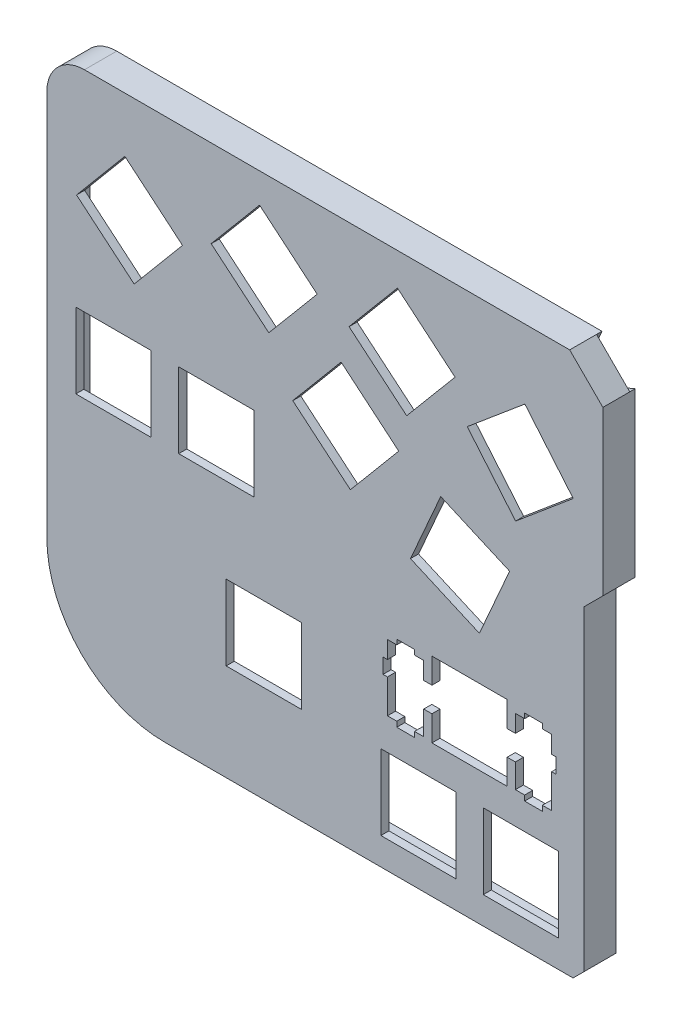
from build123d import *

# Parameters (mm, degrees)
MODEL_W         = 13.9993
MODEL_H         = 13.9993
EXTRUDE_1_DEPTH = 1.5
EXTRUDE_START   = 3.5
EXTRUDE_2_DEPTH = 3.5
CHAMFER_1_SIZE  = 2
EXTRUDE_START_2 = 1
EXTRUDE_3_DEPTH = 1


with BuildPart() as part:
    # Model → 凸台-拉伸1 (new body)
    with BuildSketch(Plane.XY):
        with BuildLine():
            Line((45.999313773, 49.434568323), (-44.302972349, 49.434568323))
            ThreePointArc((-44.302972349, 49.434568323), (-49.252719817, 47.384315792), (-51.302972349, 42.434568323))
            Line((-51.302972349, 42.434568323), (-51.302972349, -29.48760905))
            ThreePointArc((-51.302972349, -29.48760905), (-44.859321535, -45.043958236), (-29.302972349, -51.48760905))
            Line((-29.302972349, -51.48760905), (48.628680412, -51.48760905))
            Line((48.628680412, -51.48760905), (48.628680412, 9.328079248))
            Line((48.628680412, 9.328079248), (52.178865693, 12.878264529))
            Line((52.178865693, 12.878264529), (52.178865693, 43.255016404))
            Line((52.178865693, 43.255016404), (45.999313773, 49.434568323))
        make_face()
        Polygon((37.658208977, 36.530428762), (26.934123004, 27.531852177), (35.932699588, 16.807766205), (46.656785561, 25.806342789), align=None, mode=Mode.SUBTRACT)
        Polygon((13.937335593, 43.369798663), (4.938759009, 32.64571269), (15.662844981, 23.647136106), (24.661421566, 34.371222079), align=None, mode=Mode.SUBTRACT)
        Polygon((-11.724299854, 43.912488191), (-20.722876438, 33.188402219), (-9.998790465, 24.189825635), (-1.000213881, 34.913911607), align=None, mode=Mode.SUBTRACT)
        Polygon((-36.782315633, 39.237800689), (-45.780892217, 28.513714717), (-35.056806244, 19.515138133), (-26.05822966, 30.239224105), align=None, mode=Mode.SUBTRACT)
        Polygon((34.81841009, 8.16776686), (22.000122493, 13.79554649), (16.372342863, 0.977258893), (29.19063046, -4.650520737), align=None, mode=Mode.SUBTRACT)
        Polygon((3.45628169, 26.205455431), (-5.542294894, 15.481369459), (5.181791078, 6.482792875), (14.180367663, 17.206878847), align=None, mode=Mode.SUBTRACT)
        with Locations((17.862828836, -39.410351083)):
            Rectangle(MODEL_W, MODEL_H, mode=Mode.SUBTRACT)
        with Locations((36.913128836, -39.410351083)):
            Rectangle(MODEL_W, MODEL_H, mode=Mode.SUBTRACT)
        Polygon((20.363631661, -17.43145013), (18.837631661, -17.43145013), (18.837631661, -14.20145013), (17.112631661, -14.20145013), (17.112631661, -13.28205013), (13.813631661, -13.28205013), (13.813631661, -14.20145013), (12.086831661, -14.20145013), (12.086831661, -17.43145013), (11.262731661, -17.43145013), (11.262731661, -20.23165013), (12.086831661, -20.23165013), (12.086831661, -26.50175013), (13.813631661, -26.50175013), (13.813631661, -27.48155013), (17.112631661, -27.48155013), (17.112631661, -26.50175013), (18.837631661, -26.50175013), (18.837631661, -22.03145013), (20.363631661, -22.03145013), (20.363631661, -26.73185013), (34.362631661, -26.73185013), (34.362631661, -22.03145013), (35.888631661, -22.03145013), (35.888631661, -26.50175013), (37.613631661, -26.50175013), (37.613631661, -27.48155013), (40.912631661, -27.48155013), (40.912631661, -26.50175013), (42.637631661, -26.50175013), (42.637631661, -20.23165013), (43.463631661, -20.23165013), (43.463631661, -17.43145013), (42.637631661, -17.43145013), (42.637631661, -14.20145013), (40.912631661, -14.20145013), (40.912631661, -13.28205013), (37.613631661, -13.28205013), (37.613631661, -14.20145013), (35.888631661, -14.20145013), (35.888631661, -17.43145013), (34.362631661, -17.43145013), (34.362631661, -12.73245013), (20.363631661, -12.73245013), align=None, mode=Mode.SUBTRACT)
        with Locations((-38.908302282, 3.381462696)):
            Rectangle(MODEL_W, MODEL_H, mode=Mode.SUBTRACT)
        with Locations((-19.758451091, 3.325597175)):
            Rectangle(MODEL_W, MODEL_H, mode=Mode.SUBTRACT)
        with Locations((-10.932627063, -26.471328106)):
            Rectangle(MODEL_W, MODEL_H, mode=Mode.SUBTRACT)
    extrude(amount=EXTRUDE_1_DEPTH)

    # 草图1 → 凸台-拉伸2 (add)
    with BuildSketch(Plane(origin=(0, 0, 0), x_dir=(-1, 0, 0), z_dir=(0, 0, -1)).offset(EXTRUDE_START)):
        with BuildLine():
            Line((51.302972349, -29.48760905), (51.302972349, 42.434568323))
            ThreePointArc((51.302972349, 42.434568323), (49.252719817, 47.384315792), (44.302972349, 49.434568323))
            Line((44.302972349, 49.434568323), (-45.999313773, 49.434568323))
            Line((-45.999313773, 49.434568323), (-52.178865693, 43.255016404))
            Line((-52.178865693, 43.255016404), (-52.178865693, 12.878264529))
            Line((-52.178865693, 12.878264529), (-48.628680412, 9.328079248))
            Line((-48.628680412, 9.328079248), (-48.628680412, -51.48760905))
            Line((-48.628680412, -51.48760905), (29.302972349, -51.48760905))
            ThreePointArc((29.302972349, -51.48760905), (44.859321535, -45.043958236), (51.302972349, -29.48760905))
        make_face()
        with BuildLine():
            Line((44.302972349, 46.434568323), (-44.756673086, 46.434568323))
            Line((-44.756673086, 46.434568323), (-49.178865693, 42.012375717))
            Line((-49.178865693, 42.012375717), (-49.178865693, 14.120905216))
            Line((-49.178865693, 14.120905216), (-45.628680412, 10.570719935))
            Line((-45.628680412, 10.570719935), (-45.628680412, -48.48760905))
            Line((-45.628680412, -48.48760905), (29.302972349, -48.48760905))
            ThreePointArc((29.302972349, -48.48760905), (42.738001191, -42.922637892), (48.302972349, -29.48760905))
            Line((48.302972349, -29.48760905), (48.302972349, 42.434568323))
            ThreePointArc((48.302972349, 42.434568323), (47.131399474, 45.262995448), (44.302972349, 46.434568323))
        make_face(mode=Mode.SUBTRACT)
    extrude(amount=-EXTRUDE_2_DEPTH)

    # 倒角1
    chamfer_1_edges = [part.edges().sort_by_distance(p)[0] for p in [
        (48.628680412, -51.48760905, -1),
    ]]
    chamfer(chamfer_1_edges, length=CHAMFER_1_SIZE)

    # 草图2 → 凸台-拉伸3 (add)
    with BuildSketch(Plane(origin=(0, 0, -3.5), x_dir=(-1, 0, 0), z_dir=(0, 0, -1)).offset(EXTRUDE_START_2)):
        with BuildLine():
            Line((-52.178865693, 43.255016404), (-50.278865693, 42.468010635))
            Line((-50.278865693, 42.468010635), (-50.278865693, 13.665270298))
            Line((-50.278865693, 13.665270298), (-46.728680412, 10.115085017))
            Line((-46.728680412, 10.115085017), (-46.728680412, -48.700603281))
            Line((-46.728680412, -48.700603281), (-45.841674643, -49.58760905))
            Line((-45.841674643, -49.58760905), (29.302972349, -49.58760905))
            ThreePointArc((29.302972349, -49.58760905), (43.515818651, -43.700455352), (49.402972349, -29.48760905))
            Line((49.402972349, -29.48760905), (49.402972349, 42.434568323))
            ThreePointArc((49.402972349, 42.434568323), (47.909216933, 46.040812908), (44.302972349, 47.534568323))
            Line((44.302972349, 47.534568323), (-45.212308005, 47.534568323))
            Line((-45.212308005, 47.534568323), (-45.999313773, 49.434568323))
            Line((-45.999313773, 49.434568323), (44.302972349, 49.434568323))
            ThreePointArc((44.302972349, 49.434568323), (49.252719817, 47.384315792), (51.302972349, 42.434568323))
            Line((51.302972349, 42.434568323), (51.302972349, -29.48760905))
            ThreePointArc((51.302972349, -29.48760905), (44.859321535, -45.043958236), (29.302972349, -51.48760905))
            Line((29.302972349, -51.48760905), (-46.628680412, -51.48760905))
            Line((-46.628680412, -51.48760905), (-48.628680412, -49.48760905))
            Line((-48.628680412, -49.48760905), (-48.628680412, 9.328079248))
            Line((-48.628680412, 9.328079248), (-52.178865693, 12.878264529))
            Line((-52.178865693, 12.878264529), (-52.178865693, 43.255016404))
        make_face()
    extrude(amount=-EXTRUDE_3_DEPTH)


solid = part.part
